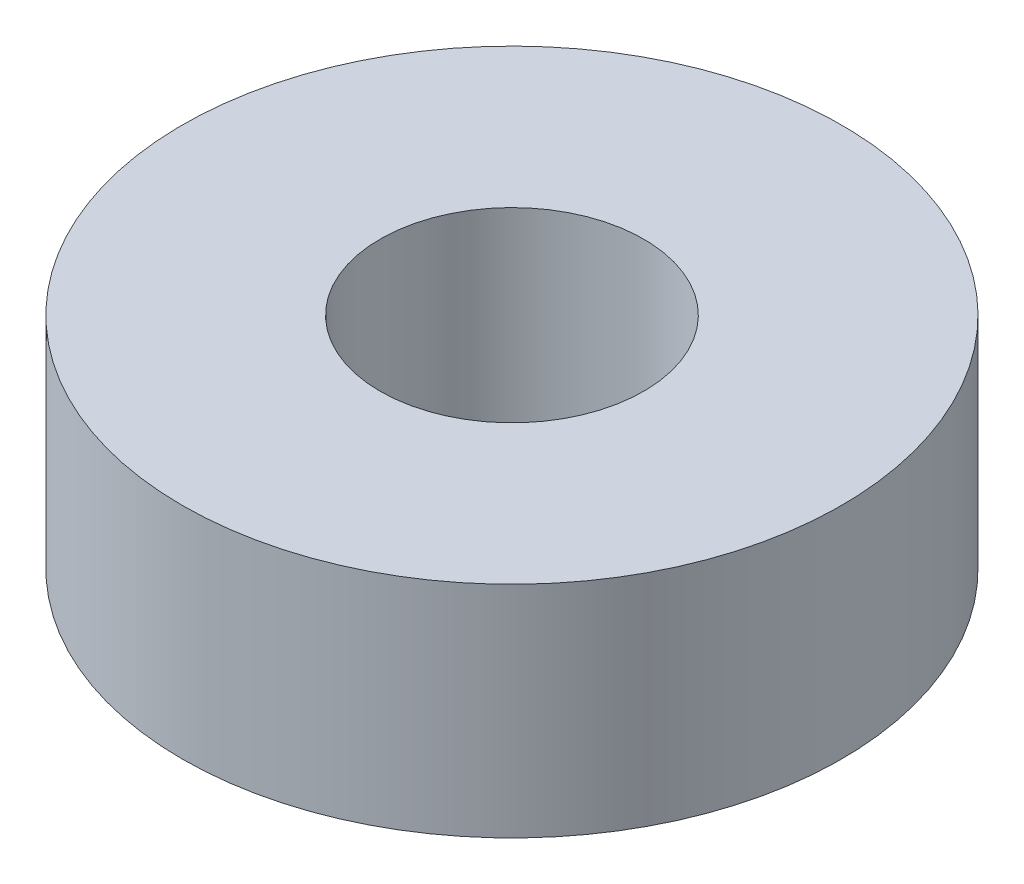
from build123d import *

# Parameters (mm, degrees)
SKETCH_1_R      = 7.5
SKETCH_1_R_2    = 3
EXTRUDE_1_DEPTH = 5


with BuildPart() as part:
    # 草图1 → 凸台-拉伸1 (new body)
    with BuildSketch(Plane(origin=(0, 0, 0), x_dir=(1, 0, 0), z_dir=(0, 1, 0))):
        with Locations(Location((0, 0, 0), (0, 0, 270))):
            Circle(SKETCH_1_R)
        with Locations(Location((0, 0, 0), (0, 0, 270))):
            Circle(SKETCH_1_R_2, mode=Mode.SUBTRACT)
    extrude(amount=EXTRUDE_1_DEPTH)


solid = part.part
